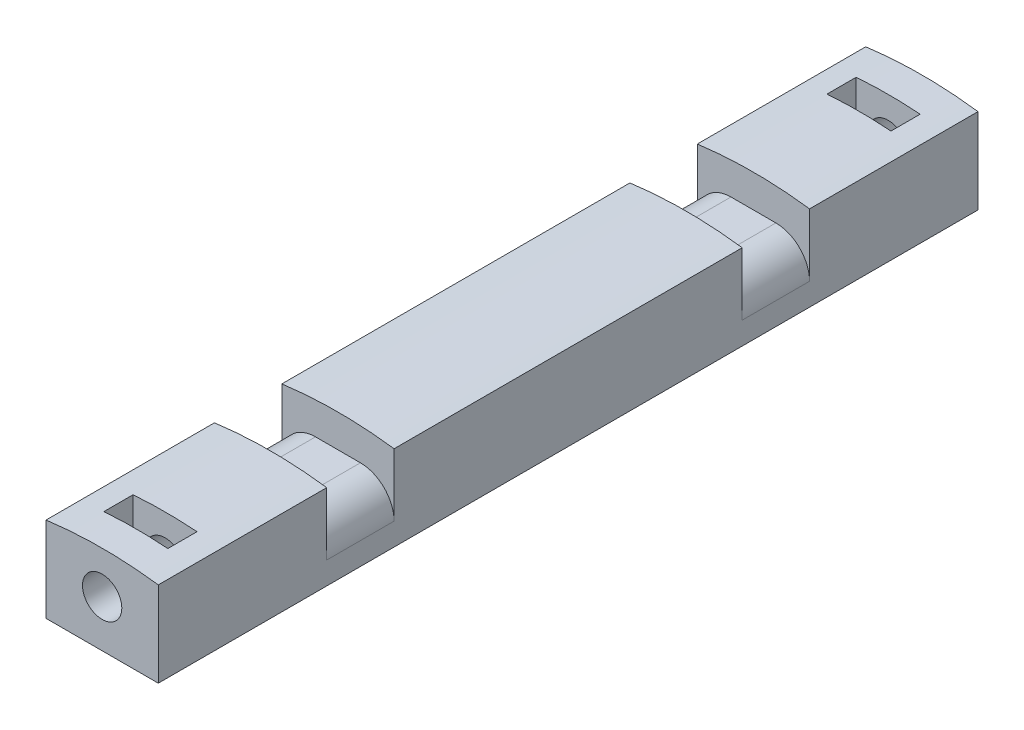
from build123d import *

# Parameters (mm, degrees)
BOSS_EXTRU_2_DEPTH      = 73
ESQUISSE6_W             = 6
ESQUISSE6_H             = 5
ENL_V_MAT_EXTRU_3_DEPTH = 83.675570757
ESQUISSE7_R             = 1.75
ENL_V_MAT_EXTRU_4_DEPTH = 12
ENL_V_START             = -12
ESQUISSE8_R             = 1.75
ENL_V_MAT_EXTRU_5_DEPTH = 12
CONG_1_R                = 3
ENL_V_START_2           = -3
ENL_V_MAT_EXTRU_6_DEPTH = 2.6
ENL_V_START_3           = -5.6
ENL_V_MAT_EXTRU_7_DEPTH = 2.6


with BuildPart() as part:
    # Esquisse3 → Boss.-Extru.2 (new body)
    with BuildSketch(Plane.XY):
        with BuildLine():
            ThreePointArc((-5, 37.165171868), (0, 37.5), (5, 37.165171868))
            Line((5, 37.165171868), (5, 29.580398915))
            Line((5, 29.580398915), (-5, 29.580398915))
            Line((-5, 29.580398915), (-5, 37.165171868))
        make_face()
    extrude(amount=BOSS_EXTRU_2_DEPTH)

    # Esquisse6 → Enlèv. mat.-Extru.3 (cut, through all)
    with BuildSketch(Plane.ZY.offset(5)):
        with Locations((18, 37.080398915)):
            Rectangle(ESQUISSE6_W, ESQUISSE6_H)
        with Locations((55, 37.080398915)):
            Rectangle(ESQUISSE6_W, ESQUISSE6_H)
    extrude(amount=-ENL_V_MAT_EXTRU_3_DEPTH, mode=Mode.SUBTRACT)

    # Esquisse7 → Enlèv. mat.-Extru.4 (cut)
    with BuildSketch(Plane.XY.offset(73)):
        with Locations((0, 33.75)):
            Circle(ESQUISSE7_R)
    extrude(amount=-ENL_V_MAT_EXTRU_4_DEPTH, mode=Mode.SUBTRACT)

    # Esquisse8 → Enlèv. mat.-Extru.5 (cut)
    with BuildSketch(Plane(origin=(0, 0, 0), x_dir=(-1, 0, 0), z_dir=(0, 0, -1)).offset(ENL_V_START)):
        with Locations(Location((0, 33.75, 0), (0, 0, 180))):
            Circle(ESQUISSE8_R)
    extrude(amount=ENL_V_MAT_EXTRU_5_DEPTH, mode=Mode.SUBTRACT)

    # Congé1
    cong_1_edges = [part.edges().sort_by_distance(p)[0] for p in [
        (5, 34.580398915, 18),
        (-5, 34.580398915, 18),
        (5, 34.580398915, 55),
        (-5, 34.580398915, 55),
    ]]
    fillet(cong_1_edges, radius=CONG_1_R)

    # Esquisse9 → Enlèv. mat.-Extru.6 (cut)
    with BuildSketch(Plane(origin=(0, 0, 0), x_dir=(-1, 0, 0), z_dir=(0, 0, -1)).offset(ENL_V_START_2)):
        with BuildLine():
            Line((-2.85, 37.391543162), (-2.85, 31.995448267))
            Line((-2.85, 31.995448267), (0, 30.35))
            Line((0, 30.35), (2.85, 31.995448267))
            Line((2.85, 31.995448267), (2.85, 37.391543162))
            ThreePointArc((2.85, 37.391543162), (0, 37.5), (-2.85, 37.391543162))
        make_face()
    extrude(amount=-ENL_V_MAT_EXTRU_6_DEPTH, mode=Mode.SUBTRACT)

    # Esquisse10 → Enlèv. mat.-Extru.7 (cut)
    with BuildSketch(Plane.XY.offset(73).offset(ENL_V_START_3)):
        with BuildLine():
            Line((-2.85, 37.391543162), (-2.85, 31.995448267))
            Line((-2.85, 31.995448267), (0, 30.35))
            Line((0, 30.35), (2.85, 31.995448267))
            Line((2.85, 31.995448267), (2.85, 37.391543162))
            ThreePointArc((2.85, 37.391543162), (0, 37.5), (-2.85, 37.391543162))
        make_face()
    extrude(amount=ENL_V_MAT_EXTRU_7_DEPTH, mode=Mode.SUBTRACT)


solid = part.part
